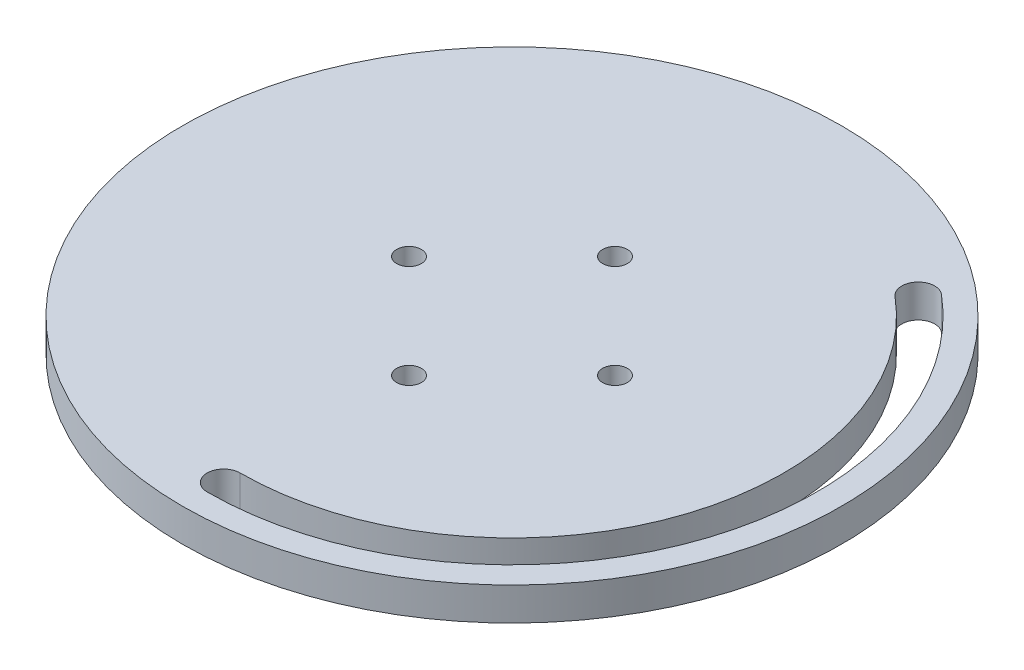
from build123d import *

# Parameters (mm, degrees)
SKETCH1_R           = 40
SKETCH1_R_2         = 1.5
BOSS_EXTRUDE1_DEPTH = 4


with BuildPart() as part:
    # Sketch1 → Boss-Extrude1 (new body)
    with BuildSketch(Plane(origin=(0, 0, 0), x_dir=(1, 0, 0), z_dir=(0, 1, 0))):
        with Locations(Location((0, 0, 0), (0, 0, 270))):
            Circle(SKETCH1_R)
        with Locations(Location((0, -12.5, 0), (0, 0, 270))):
            Circle(SKETCH1_R_2, mode=Mode.SUBTRACT)
        with Locations(Location((-12.5, 0, 0), (0, 0, 270))):
            Circle(SKETCH1_R_2, mode=Mode.SUBTRACT)
        with Locations(Location((0, 12.5, 0), (0, 0, 270))):
            Circle(SKETCH1_R_2, mode=Mode.SUBTRACT)
        with Locations(Location((12.5, 0, 0), (0, 0, 270))):
            Circle(SKETCH1_R_2, mode=Mode.SUBTRACT)
        with BuildLine():
            ThreePointArc((23.783141558, 28.343644395), (20.965477453, 28.097130729), (21.21199112, 25.279466623))
            ThreePointArc((21.21199112, 25.279466623), (31.009856486, -11.28666473), (0, -33))
            ThreePointArc((0, -33), (-2, -35), (0, -37))
            ThreePointArc((0, -37), (34.768626969, -12.654745303), (23.783141558, 28.343644395))
        make_face(mode=Mode.SUBTRACT)
    extrude(amount=BOSS_EXTRUDE1_DEPTH)


solid = part.part
